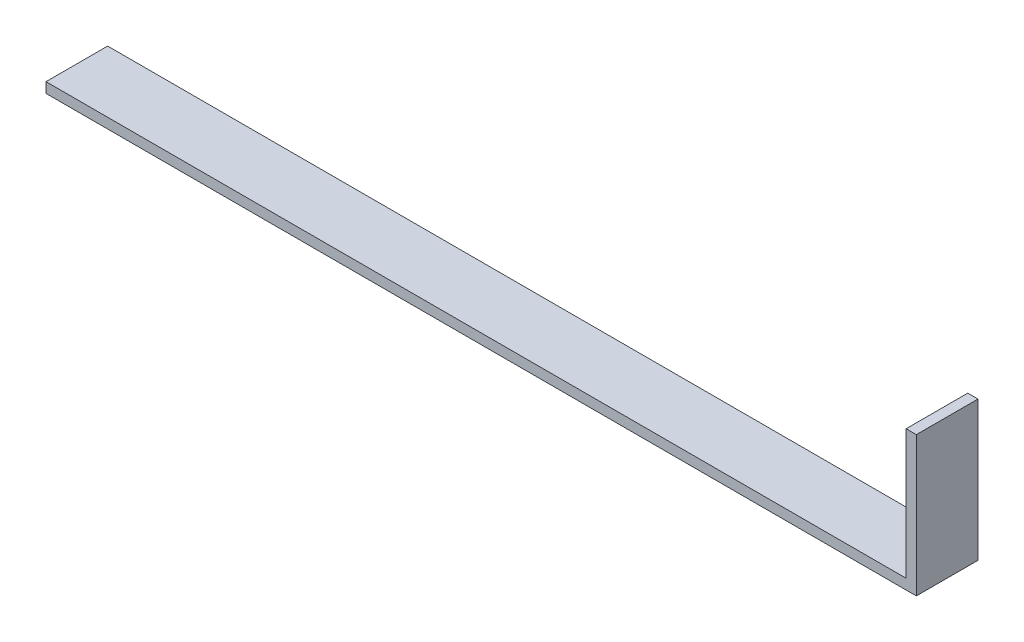
from build123d import *

# Parameters (mm, degrees)
SALIENTE_EXTRUIR1_DEPTH = 38.1
CROQUIS4_W              = 140.392352489
CROQUIS4_H              = 38.1
CORTAR_EXTRUIR2_DEPTH   = 6.31
CROQUIS5_W              = 38.1
CROQUIS5_H              = 6.31
SALIENTE_EXTRUIR2_DEPTH = 328.45


with BuildPart() as part:
    # Croquis1 → Saliente-Extruir1 (new body)
    with BuildSketch(Plane.XY):
        Polygon((0, 0), (202.937647511, 0), (202.937647511, 80), (349.64, 80), (349.64, 73.69), (209.247647511, 73.69), (209.247647511, -6.31), (0, -6.31), align=None)
    extrude(amount=SALIENTE_EXTRUIR1_DEPTH)

    # Croquis4 → Cortar-Extruir2 (cut)
    with BuildSketch(Plane.XZ.offset(-73.69)):
        with Locations((279.443823756, 19.05)):
            Rectangle(CROQUIS4_W, CROQUIS4_H)
    extrude(amount=-CORTAR_EXTRUIR2_DEPTH, mode=Mode.SUBTRACT)

    # Croquis5 → Saliente-Extruir2 (add)
    with BuildSketch(Plane.ZY):
        with Locations((19.05, -3.155)):
            Rectangle(CROQUIS5_W, CROQUIS5_H)
    extrude(amount=SALIENTE_EXTRUIR2_DEPTH)


solid = part.part
